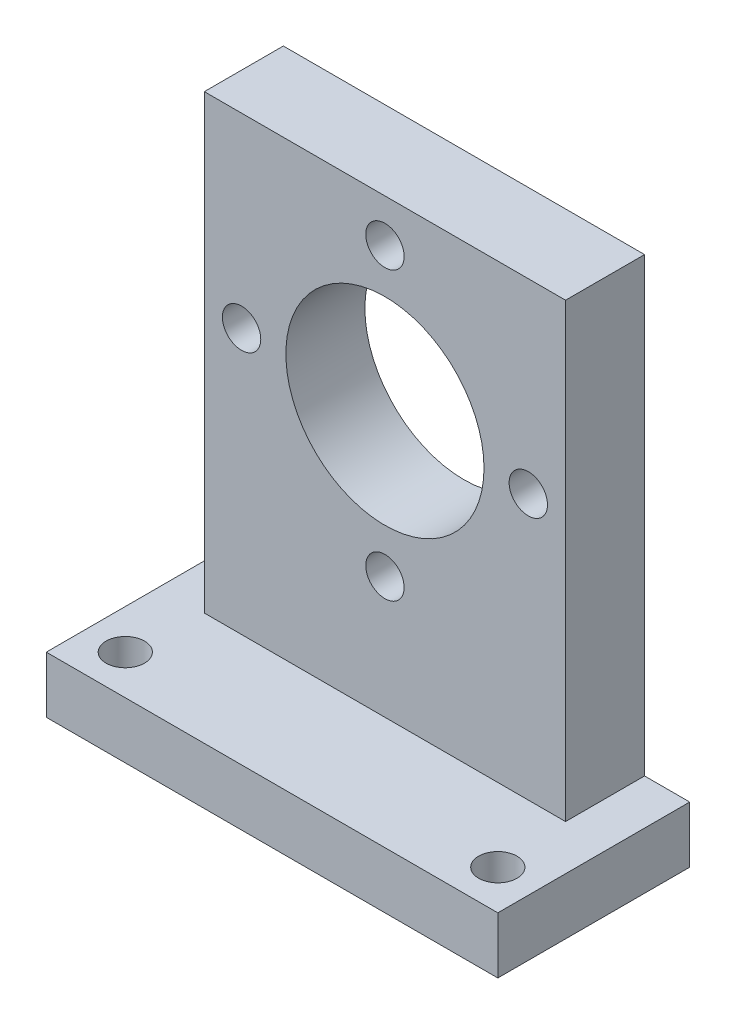
from build123d import *

# Parameters (mm, degrees)
SKETCH1_W           = 40
SKETCH1_H           = 27
SKETCH1_W_2         = 32
SKETCH1_H_2         = 7
BOSS_EXTRUDE1_DEPTH = 5
SKETCH1_3_W         = 32
SKETCH1_3_H         = 7
BOSS_EXTRUDE2_DEPTH = 45
CUT_EXTRUDE1_REACH  = 54.096
SKETCH2_R           = 8.7757
CUT_EXTRUDE2_REACH  = 54.096
SKETCH4_R           = 1.7
CUT_EXTRUDE3_REACH  = 48.715
SKETCH5_R           = 1.7
CUT_EXTRUDE5_REACH  = 48.715
SKETCH7_W           = 40
SKETCH7_H           = 10
SKETCH8_R           = 1.7
CUT_EXTRUDE6_DEPTH  = 6.35


with BuildPart() as part:
    # Sketch1 → Boss-Extrude1 (new body)
    with BuildSketch(Plane(origin=(0, 0, 0), x_dir=(1, 0, 0), z_dir=(0, 1, 0))):
        Rectangle(SKETCH1_W, SKETCH1_H)
        Rectangle(SKETCH1_W_2, SKETCH1_H_2, mode=Mode.SUBTRACT)
    extrude(amount=BOSS_EXTRUDE1_DEPTH)

    # Sketch1<3> → Boss-Extrude2 (add)
    with BuildSketch(Plane(origin=(0, 0, 0), x_dir=(1, 0, 0), z_dir=(0, 1, 0))):
        Rectangle(SKETCH1_3_W, SKETCH1_3_H)
    extrude(amount=BOSS_EXTRUDE2_DEPTH)

    # Sketch2 → Cut-Extrude1 (cut, up to next)
    with BuildSketch(Plane.XY.offset(3.5), mode=Mode.PRIVATE) as cut_extrude1_sk1:
        with Locations((0, 28.5)):
            Circle(SKETCH2_R)
    cut_extrude1_tool1 = extrude(cut_extrude1_sk1.sketch, amount=-CUT_EXTRUDE1_REACH, mode=Mode.PRIVATE) & part.part
    add(cut_extrude1_tool1.solids().sort_by_distance((0, 28.5, 3.5))[0], mode=Mode.SUBTRACT)

    # Sketch4 → Cut-Extrude2 (cut, up to next)
    with BuildSketch(Plane.XY.offset(3.5), mode=Mode.PRIVATE) as cut_extrude2_sk1:
        with Locations((0, 41.2)):
            Circle(SKETCH4_R)
    cut_extrude2_tool1 = extrude(cut_extrude2_sk1.sketch, amount=-CUT_EXTRUDE2_REACH, mode=Mode.PRIVATE) & part.part
    # Sketch4 → Cut-Extrude2 (cut, up to next)
    with BuildSketch(Plane.XY.offset(3.5), mode=Mode.PRIVATE) as cut_extrude2_sk2:
        with Locations((12.7, 28.5)):
            Circle(SKETCH4_R)
    cut_extrude2_tool2 = extrude(cut_extrude2_sk2.sketch, amount=-CUT_EXTRUDE2_REACH, mode=Mode.PRIVATE) & part.part
    # Sketch4 → Cut-Extrude2 (cut, up to next)
    with BuildSketch(Plane.XY.offset(3.5), mode=Mode.PRIVATE) as cut_extrude2_sk3:
        with Locations((0, 15.8)):
            Circle(SKETCH4_R)
    cut_extrude2_tool3 = extrude(cut_extrude2_sk3.sketch, amount=-CUT_EXTRUDE2_REACH, mode=Mode.PRIVATE) & part.part
    # Sketch4 → Cut-Extrude2 (cut, up to next)
    with BuildSketch(Plane.XY.offset(3.5), mode=Mode.PRIVATE) as cut_extrude2_sk4:
        with Locations((-12.7, 28.5)):
            Circle(SKETCH4_R)
    cut_extrude2_tool4 = extrude(cut_extrude2_sk4.sketch, amount=-CUT_EXTRUDE2_REACH, mode=Mode.PRIVATE) & part.part
    add(cut_extrude2_tool1.solids().sort_by_distance((0, 41.2, 3.5))[0], mode=Mode.SUBTRACT)
    add(cut_extrude2_tool2.solids().sort_by_distance((12.7, 28.5, 3.5))[0], mode=Mode.SUBTRACT)
    add(cut_extrude2_tool3.solids().sort_by_distance((0, 15.8, 3.5))[0], mode=Mode.SUBTRACT)
    add(cut_extrude2_tool4.solids().sort_by_distance((-12.7, 28.5, 3.5))[0], mode=Mode.SUBTRACT)

    # Sketch5 → Cut-Extrude3 (cut, up to next)
    with BuildSketch(Plane(origin=(0, 5, 0), x_dir=(1, 0, 0), z_dir=(0, 1, 0)), mode=Mode.PRIVATE) as cut_extrude3_sk1:
        with Locations((-16.5, 10)):
            Circle(SKETCH5_R)
    cut_extrude3_tool1 = extrude(cut_extrude3_sk1.sketch, amount=-CUT_EXTRUDE3_REACH, mode=Mode.PRIVATE) & part.part
    # Sketch5 → Cut-Extrude3 (cut, up to next)
    with BuildSketch(Plane(origin=(0, 5, 0), x_dir=(1, 0, 0), z_dir=(0, 1, 0)), mode=Mode.PRIVATE) as cut_extrude3_sk2:
        with Locations((-16.5, -10)):
            Circle(SKETCH5_R)
    cut_extrude3_tool2 = extrude(cut_extrude3_sk2.sketch, amount=-CUT_EXTRUDE3_REACH, mode=Mode.PRIVATE) & part.part
    # Sketch5 → Cut-Extrude3 (cut, up to next)
    with BuildSketch(Plane(origin=(0, 5, 0), x_dir=(1, 0, 0), z_dir=(0, 1, 0)), mode=Mode.PRIVATE) as cut_extrude3_sk3:
        with Locations((16.5, -10)):
            Circle(SKETCH5_R)
    cut_extrude3_tool3 = extrude(cut_extrude3_sk3.sketch, amount=-CUT_EXTRUDE3_REACH, mode=Mode.PRIVATE) & part.part
    # Sketch5 → Cut-Extrude3 (cut, up to next)
    with BuildSketch(Plane(origin=(0, 5, 0), x_dir=(1, 0, 0), z_dir=(0, 1, 0)), mode=Mode.PRIVATE) as cut_extrude3_sk4:
        with Locations((16.5, 10)):
            Circle(SKETCH5_R)
    cut_extrude3_tool4 = extrude(cut_extrude3_sk4.sketch, amount=-CUT_EXTRUDE3_REACH, mode=Mode.PRIVATE) & part.part
    add(cut_extrude3_tool1.solids().sort_by_distance((-16.5, 5, -10))[0], mode=Mode.SUBTRACT)
    add(cut_extrude3_tool2.solids().sort_by_distance((-16.5, 5, 10))[0], mode=Mode.SUBTRACT)
    add(cut_extrude3_tool3.solids().sort_by_distance((16.5, 5, 10))[0], mode=Mode.SUBTRACT)
    add(cut_extrude3_tool4.solids().sort_by_distance((16.5, 5, -10))[0], mode=Mode.SUBTRACT)

    # Sketch7 → Cut-Extrude5 (cut, up to next)
    with BuildSketch(Plane(origin=(0, 5, 0), x_dir=(1, 0, 0), z_dir=(0, 1, 0)), mode=Mode.PRIVATE) as cut_extrude5_sk1:
        with Locations((0, 8.5)):
            Rectangle(SKETCH7_W, SKETCH7_H)
    cut_extrude5_tool1 = extrude(cut_extrude5_sk1.sketch, amount=-CUT_EXTRUDE5_REACH, mode=Mode.PRIVATE) & part.part
    add(cut_extrude5_tool1.solids().sort_by_distance((0, 5, -8.5))[0], mode=Mode.SUBTRACT)

    # Sketch8 → Cut-Extrude6 (cut)
    with BuildSketch(Plane(origin=(0, 0, -3.5), x_dir=(-1, 0, 0), z_dir=(0, 0, -1))):
        with Locations((-12.7, 2.5)):
            Circle(SKETCH8_R)
        with Locations((12.7, 2.5)):
            Circle(SKETCH8_R)
    extrude(amount=-CUT_EXTRUDE6_DEPTH, mode=Mode.SUBTRACT)


solid = part.part
